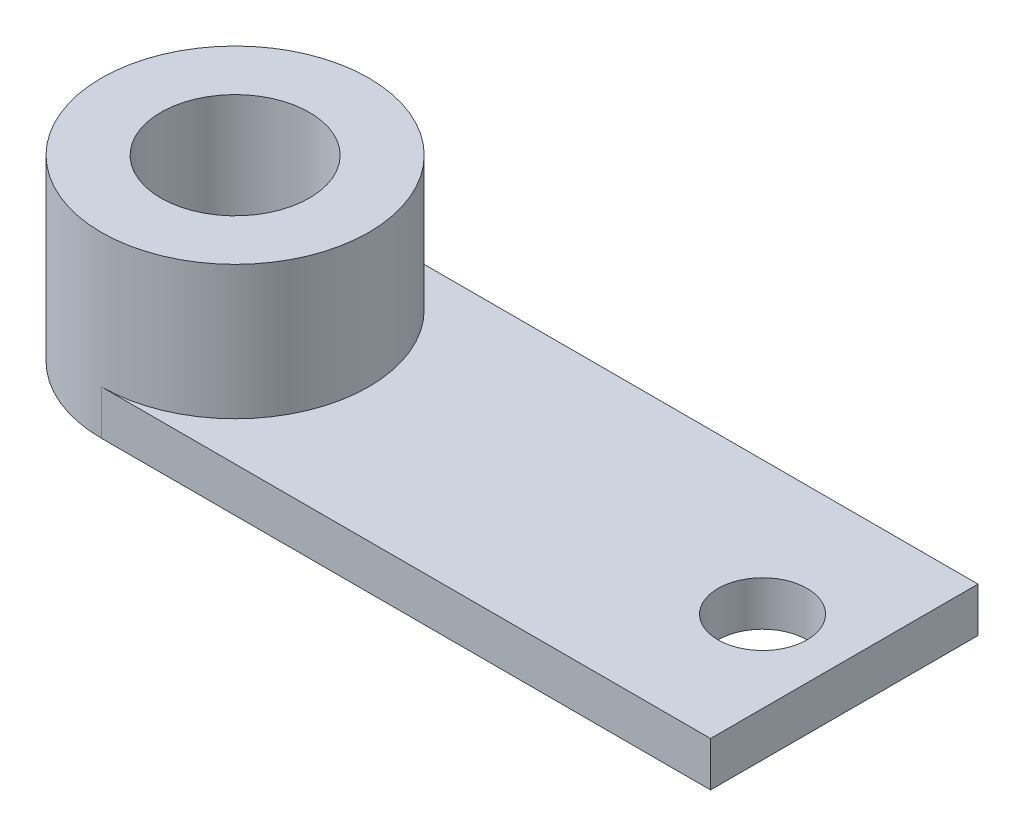
from build123d import *

# Parameters (mm, degrees)
SKETCH2_W               = 25
SKETCH2_H               = 9
BOSS_EXTRUDE3_DEPTH     = 6
SKETCH3_R               = 2.5
CUT_EXTRUDE1_DEPTH      = 4.5
CUT_EXTRUDE2_DEPTH      = 28.239676944
CUT_EXTRUDE2_DEPTH_BACK = 28.239676944
SKETCH4_R               = 1.5
SKETCH5_R               = 1.5
CUT_EXTRUDE3_DEPTH      = 4.5
CUT_EXTRUDE4_DEPTH      = 28.239676944


with BuildPart() as part:
    # Sketch2 → Boss-Extrude3 (new body)
    with BuildSketch(Plane(origin=(0, 0, 0), x_dir=(1, 0, 0), z_dir=(0, 1, 0))):
        with Locations((12.5, 4.5)):
            Rectangle(SKETCH2_W, SKETCH2_H)
    extrude(amount=BOSS_EXTRUDE3_DEPTH)

    # Sketch3 → Cut-Extrude1 (cut)
    with BuildSketch(Plane(origin=(0, 6, 0), x_dir=(1, 0, 0), z_dir=(0, 1, 0))):
        with Locations(Location((4.5, 4.5, 0), (0, 0, 270))):
            Circle(SKETCH3_R)
    extrude(amount=-CUT_EXTRUDE1_DEPTH, mode=Mode.SUBTRACT)

    # Sketch4 → Cut-Extrude2 (cut, two sides: drawn at the far end of the back side and taken through both)
    with BuildSketch(Plane(origin=(0, 6, 0), x_dir=(1, 0, 0), z_dir=(0, 1, 0)).offset(-CUT_EXTRUDE2_DEPTH_BACK)):
        with Locations(Location((22.25, 4.5, 0), (0, 0, 270))):
            Circle(SKETCH4_R)
    extrude(amount=CUT_EXTRUDE2_DEPTH + CUT_EXTRUDE2_DEPTH_BACK, mode=Mode.SUBTRACT)

    # Sketch5 → Cut-Extrude3 (cut)
    with BuildSketch(Plane(origin=(0, 6, 0), x_dir=(1, 0, 0), z_dir=(0, 1, 0))):
        with BuildLine():
            Line((25, 9), (4.5, 9))
            ThreePointArc((4.5, 9), (7.681980515, 7.681980515), (9, 4.5))
            ThreePointArc((9, 4.5), (7.681980515, 1.318019485), (4.5, 0))
            Line((4.5, 0), (25, 0))
            Line((25, 0), (25, 9))
        make_face()
        with Locations(Location((22.25, 4.5, 0), (0, 0, 270))):
            Circle(SKETCH5_R, mode=Mode.SUBTRACT)
    extrude(amount=-CUT_EXTRUDE3_DEPTH, mode=Mode.SUBTRACT)

    # Sketch6 → Cut-Extrude4 (cut, through all)
    with BuildSketch(Plane(origin=(0, 6, 0), x_dir=(1, 0, 0), z_dir=(0, 1, 0))):
        with BuildLine():
            ThreePointArc((0, 4.5), (1.318019485, 7.681980515), (4.5, 9))
            Line((4.5, 9), (0, 9))
            Line((0, 9), (0, 4.5))
        make_face()
        with BuildLine():
            ThreePointArc((4.5, 0), (1.318019485, 1.318019485), (0, 4.5))
            Line((0, 4.5), (0, 0))
            Line((0, 0), (4.5, 0))
        make_face()
    extrude(amount=-CUT_EXTRUDE4_DEPTH, mode=Mode.SUBTRACT)


solid = part.part
